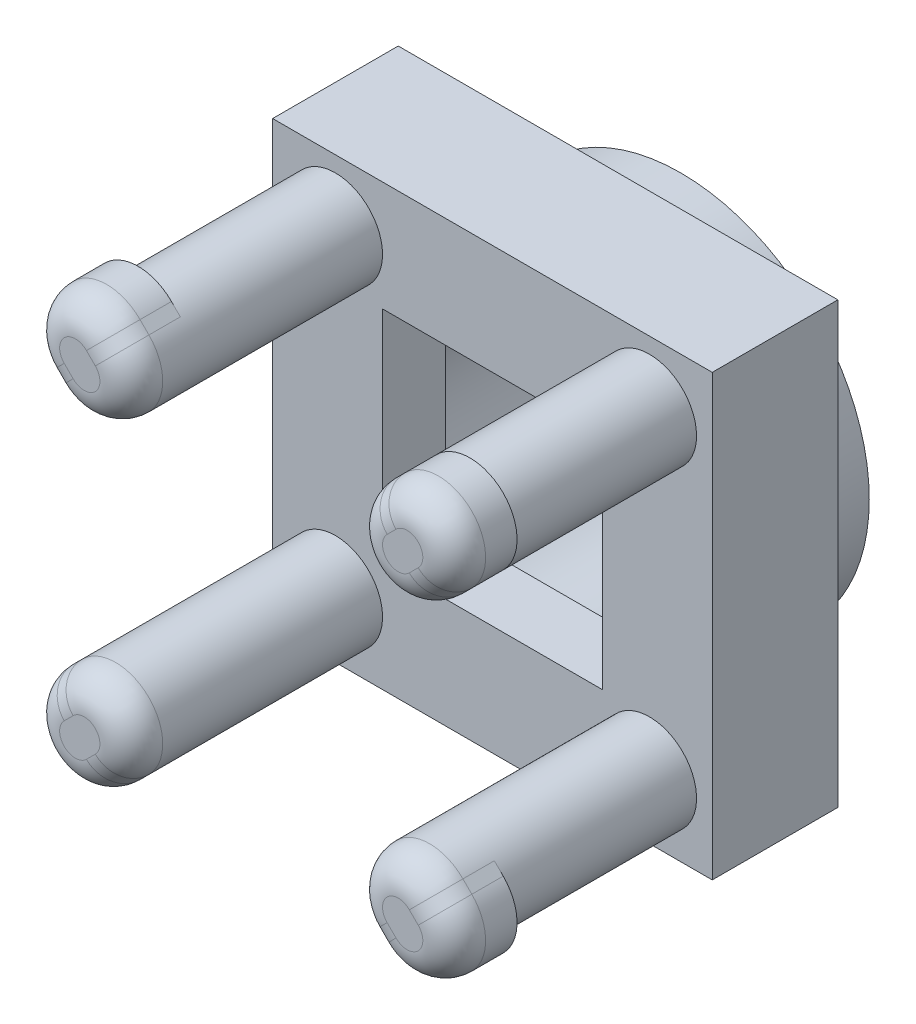
from build123d import *

# Parameters (mm, degrees)
ESQUISSE1_W                        = 7
ESQUISSE1_H                        = 7
BOSS_EXTRU_1_DEPTH                 = 2
ESQUISSE2_R                        = 3
ESQUISSE2_R_2                      = 2.032039
BOSS_EXTRU_2_DEPTH                 = 1
ESQUISSE3_R                        = 0.75
BOSS_EXTRU_3_DEPTH                 = 3
BOSS_EXTRU_4_DEPTH                 = 1
CONG_1_R                           = 0.5
R_P_TITION_CIRCULAIRE2_COUNT       = 4
CONG_1_OF_R_P_TITION_CIRCULAIRE2_R = 0.5
ESQUISSE6_W                        = 3.5
ESQUISSE6_H                        = 3.5
ENL_V_MAT_EXTRU_1_DEPTH            = 1
ENL_V_START                        = -1
ESQUISSE7_R                        = 2.032039
ENL_V_MAT_EXTRU_2_DEPTH            = 1


with BuildPart() as part:
    # Esquisse1 → Boss.-Extru.1 (new body)
    with BuildSketch(Plane.XY):
        Rectangle(ESQUISSE1_W, ESQUISSE1_H)
    extrude(amount=BOSS_EXTRU_1_DEPTH)

    # Esquisse2 → Boss.-Extru.2 (add)
    with BuildSketch(Plane(origin=(0, 0, 0), x_dir=(-1, 0, 0), z_dir=(0, 0, -1))):
        with Locations(Location((0, 0, 0), (0, 0, 180))):
            Circle(ESQUISSE2_R)
        Circle(ESQUISSE2_R_2, mode=Mode.SUBTRACT)
    extrude(amount=BOSS_EXTRU_2_DEPTH)

    # Esquisse3 → Boss.-Extru.3 (add)
    with BuildSketch(Plane(origin=(-0.00837, -0.443983, 2), x_dir=(1, 0, 0), z_dir=(0, 0, 1))):
        with Locations((-2.49163, 2.943983)):
            Circle(ESQUISSE3_R)
    boss_extru_3 = extrude(amount=BOSS_EXTRU_3_DEPTH)

    # Esquisse5 → Boss.-Extru.4 (add)
    with BuildSketch(Plane.XY.offset(5)):
        with BuildLine():
            Line((-3.03033, 1.96967), (-3.171751, 2.111091))
            ThreePointArc((-3.171751, 2.111091), (-3.171751, 3.171751), (-2.111091, 3.171751))
            Line((-2.111091, 3.171751), (-1.96967, 3.03033))
            ThreePointArc((-1.96967, 3.03033), (-1.96967, 1.96967), (-3.03033, 1.96967))
        make_face()
    boss_extru_4 = extrude(amount=BOSS_EXTRU_4_DEPTH)

    # Congé1
    cong_1_edges = [part.edges().sort_by_distance(p)[0] for p in [
        (-1.96967, 1.96967, 6),
        (-2.040381, 3.101041, 6),
        (-3.171751, 3.171751, 6),
        (-3.101041, 2.040381, 6),
    ]]
    fillet(cong_1_edges, radius=CONG_1_R)

    # Répétition circulaire2: Boss.-Extru.3, Boss.-Extru.4 ×4 about axis
    r_p_tition_circulaire2_axis = Axis((0, 0, 0), (0, 0, 1))
    add([boss_extru_3.rotate(r_p_tition_circulaire2_axis, i * 360 / R_P_TITION_CIRCULAIRE2_COUNT) for i in range(1, R_P_TITION_CIRCULAIRE2_COUNT)])
    add([boss_extru_4.rotate(r_p_tition_circulaire2_axis, i * 360 / R_P_TITION_CIRCULAIRE2_COUNT) for i in range(1, R_P_TITION_CIRCULAIRE2_COUNT)])

    # Congé1 of Répétition circulaire2
    cong_1_of_r_p_tition_circulaire2_edges = [part.edges().sort_by_distance(p)[0] for p in [
        (-1.96967, -1.96967, 6),
        (-3.101041, -2.040381, 6),
        (-3.171751, -3.171751, 6),
        (-2.040381, -3.101041, 6),
        (1.96967, -1.96967, 6),
        (2.040381, -3.101041, 6),
        (3.171751, -3.171751, 6),
        (3.101041, -2.040381, 6),
        (1.96967, 1.96967, 6),
        (3.101041, 2.040381, 6),
        (3.171751, 3.171751, 6),
        (2.040381, 3.101041, 6),
    ]]
    fillet(cong_1_of_r_p_tition_circulaire2_edges, radius=CONG_1_OF_R_P_TITION_CIRCULAIRE2_R)

    # Esquisse6 → Enlèv. mat.-Extru.1 (cut)
    with BuildSketch(Plane.XY.offset(2)):
        Rectangle(ESQUISSE6_W, ESQUISSE6_H)
    extrude(amount=-ENL_V_MAT_EXTRU_1_DEPTH, mode=Mode.SUBTRACT)

    # Esquisse7 → Enlèv. mat.-Extru.2 (cut)
    with BuildSketch(Plane(origin=(0, 0, 0), x_dir=(-1, 0, 0), z_dir=(0, 0, -1)).offset(ENL_V_START)):
        with Locations(Location((0, 0, 0), (0, 0, 149.452052))):
            Circle(ESQUISSE7_R)
    extrude(amount=ENL_V_MAT_EXTRU_2_DEPTH, mode=Mode.SUBTRACT)


solid = part.part
